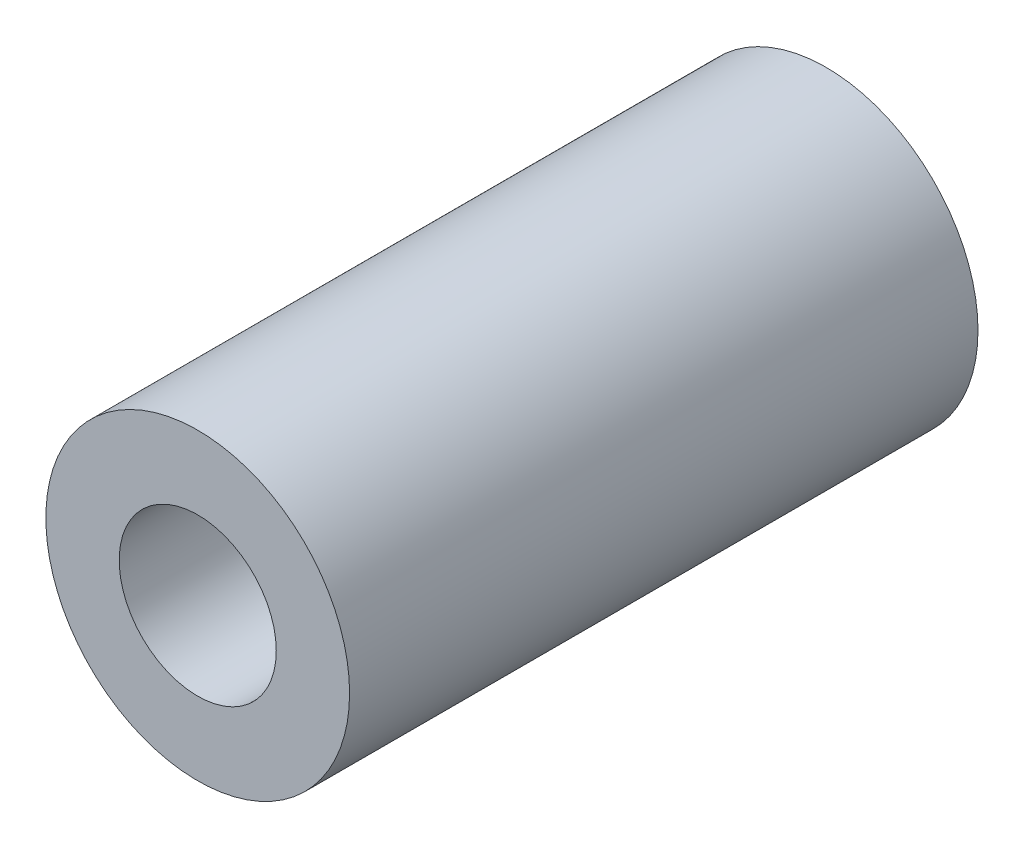
from build123d import *

# Parameters (mm, degrees)
CROQUIS1_R              = 2.9
CROQUIS1_R_2            = 1.5
SALIENTE_EXTRUIR1_DEPTH = 12


with BuildPart() as part:
    # Croquis1 → Saliente-Extruir1 (new body)
    with BuildSketch(Plane.XY):
        Circle(CROQUIS1_R)
        Circle(CROQUIS1_R_2, mode=Mode.SUBTRACT)
    extrude(amount=SALIENTE_EXTRUIR1_DEPTH)


solid = part.part
